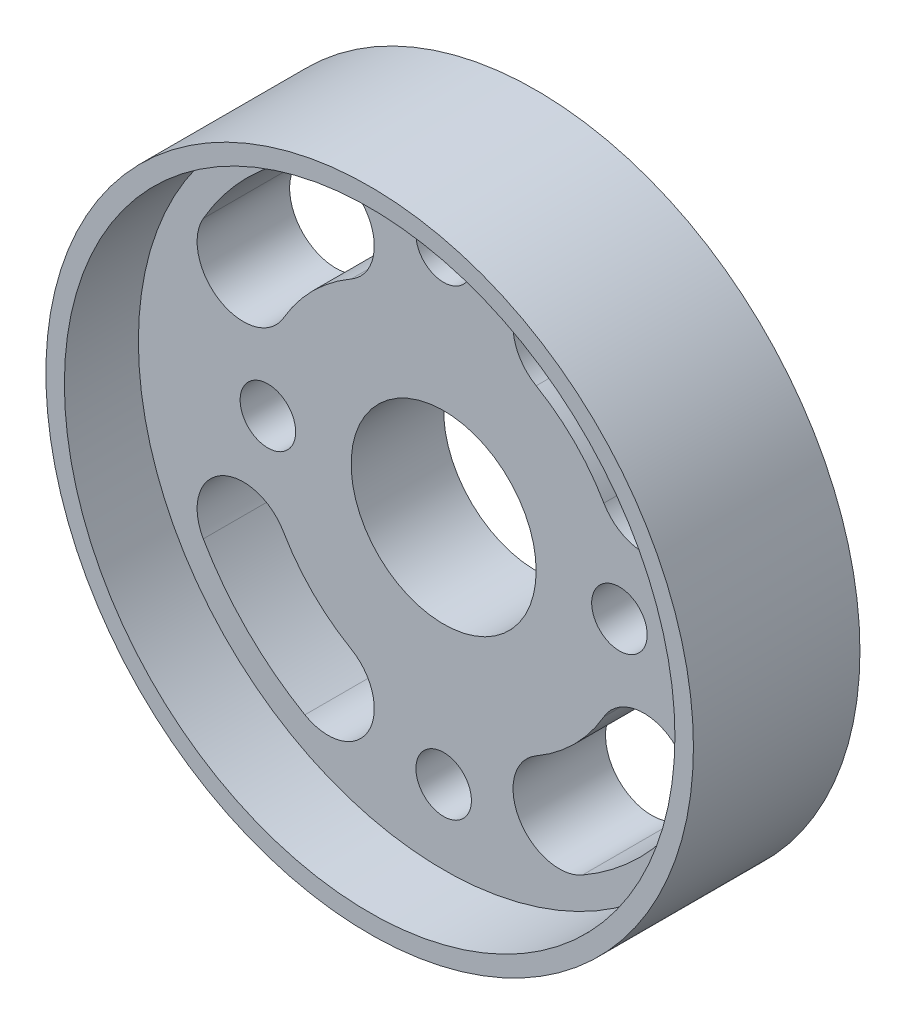
from build123d import *

# Parameters (mm, degrees)
SKETCH1_R           = 17.5
SKETCH1_R_2         = 1.5
SKETCH1_R_3         = 5
BOSS_EXTRUDE1_DEPTH = 5
SKETCH2_R           = 17.5
SKETCH2_R_2         = 16.5
EXTRUDE_THIN1_DEPTH = 4


with BuildPart() as part:
    # Sketch1 → Boss-Extrude1 (new body)
    with BuildSketch(Plane.XY):
        Circle(SKETCH1_R)
        with Locations((0, 12.5)):
            Circle(SKETCH1_R_2, mode=Mode.SUBTRACT)
        with Locations((0, -12.5)):
            Circle(SKETCH1_R_2, mode=Mode.SUBTRACT)
        Circle(SKETCH1_R_3, mode=Mode.SUBTRACT)
        with Locations((9.5, 0)):
            Circle(SKETCH1_R_2, mode=Mode.SUBTRACT)
        with Locations((-9.5, 0)):
            Circle(SKETCH1_R_2, mode=Mode.SUBTRACT)
        with BuildLine():
            ThreePointArc((-8.660254038, -5), (-7.071067812, -7.071067812), (-5, -8.660254038))
            ThreePointArc((-5, -8.660254038), (-4.084936491, -12.075317547), (-7.5, -12.990381057))
            ThreePointArc((-7.5, -12.990381057), (-10.606601718, -10.606601718), (-12.990381057, -7.5))
            ThreePointArc((-12.990381057, -7.5), (-12.075317547, -4.084936491), (-8.660254038, -5))
        make_face(mode=Mode.SUBTRACT)
        with BuildLine():
            ThreePointArc((-5, 8.660254038), (-4.084936491, 12.075317547), (-7.5, 12.990381057))
            ThreePointArc((-7.5, 12.990381057), (-10.606601718, 10.606601718), (-12.990381057, 7.5))
            ThreePointArc((-12.990381057, 7.5), (-12.075317547, 4.084936491), (-8.660254038, 5))
            ThreePointArc((-8.660254038, 5), (-7.071067812, 7.071067812), (-5, 8.660254038))
        make_face(mode=Mode.SUBTRACT)
        with BuildLine():
            ThreePointArc((5, -8.660254038), (4.084936491, -12.075317547), (7.5, -12.990381057))
            ThreePointArc((7.5, -12.990381057), (10.606601718, -10.606601718), (12.990381057, -7.5))
            ThreePointArc((12.990381057, -7.5), (12.075317547, -4.084936491), (8.660254038, -5))
            ThreePointArc((8.660254038, -5), (7.071067812, -7.071067812), (5, -8.660254038))
        make_face(mode=Mode.SUBTRACT)
        with BuildLine():
            ThreePointArc((12.990381057, 7.5), (12.075317547, 4.084936491), (8.660254038, 5))
            ThreePointArc((8.660254038, 5), (7.071067812, 7.071067812), (5, 8.660254038))
            ThreePointArc((5, 8.660254038), (4.084936491, 12.075317547), (7.5, 12.990381057))
            ThreePointArc((7.5, 12.990381057), (10.606601718, 10.606601718), (12.990381057, 7.5))
        make_face(mode=Mode.SUBTRACT)
    extrude(amount=BOSS_EXTRUDE1_DEPTH)

    # Sketch2 → Extrude-Thin1 (add)
    with BuildSketch(Plane.XY.offset(5)):
        Circle(SKETCH2_R)
        Circle(SKETCH2_R_2, mode=Mode.SUBTRACT)
    extrude(amount=EXTRUDE_THIN1_DEPTH)


solid = part.part
